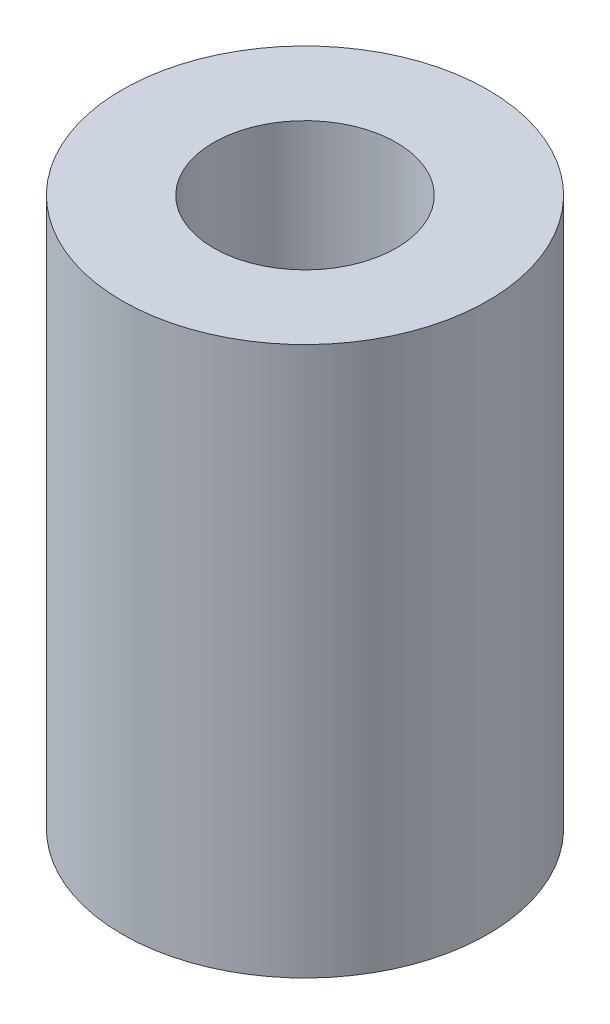
from build123d import *

# Parameters (mm, degrees)
SKETCH1_R           = 5
SKETCH1_R_2         = 2.5
BOSS_EXTRUDE1_DEPTH = 15


with BuildPart() as part:
    # Sketch1 → Boss-Extrude1 (new body)
    with BuildSketch(Plane(origin=(0, 0, 0), x_dir=(1, 0, 0), z_dir=(0, 1, 0))):
        with Locations(Location((0, 0, 0), (0, 0, 270))):
            Circle(SKETCH1_R)
        with Locations(Location((0, 0, 0), (0, 0, 270))):
            Circle(SKETCH1_R_2, mode=Mode.SUBTRACT)
    extrude(amount=BOSS_EXTRUDE1_DEPTH)


solid = part.part
